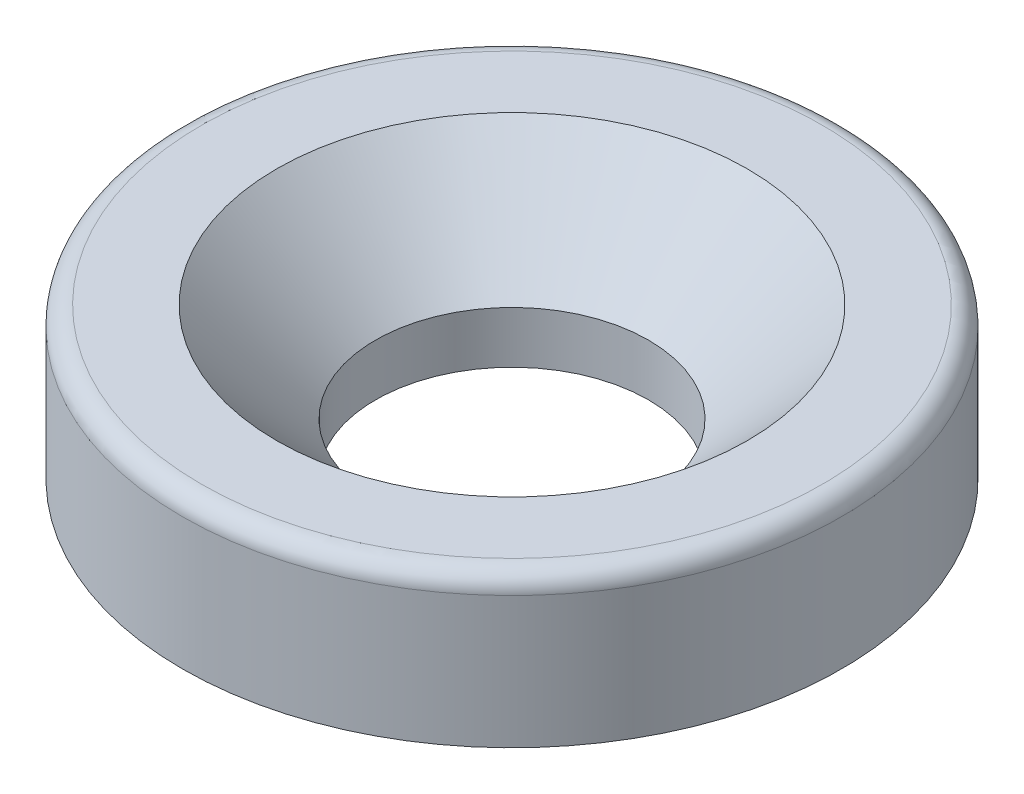
from build123d import *

# Parameters (mm, degrees)
SKETCH1_W = 17.5
SKETCH1_H = 8
FILLET1_R = 1


with BuildPart() as part:
    # Sketch1 → Revolve1 (revolve)
    with BuildSketch(Plane.XY, mode=Mode.PRIVATE) as revolve1_sk:
        with Locations((8.75, 4)):
            Rectangle(SKETCH1_W, SKETCH1_H)
    revolve(revolve1_sk.sketch.rotate(Axis((0, 0, 0), (0, 1, 0)), 90), axis=Axis((0, 0, 0), (0, 1, 0)))

    # Sketch2 → CSK for M3 Countersunk Flat Head Screw1 (revolve, cut)
    with BuildSketch(Plane(origin=(0, 8, 0), x_dir=(0, 0, 1), z_dir=(1, 0, 0))):
        Polygon((0, 0), (0, 8), (7.25, 8), (7.25, 5.25), (12.5, 0), align=None)
    revolve(axis=Axis((0, 14.35, 0), (0, -1, 0)), mode=Mode.SUBTRACT)

    # Fillet1
    fillet1_edges = [part.edges().sort_by_distance(p)[0] for p in [
        (0, 8, 17.5),
    ]]
    fillet(fillet1_edges, radius=FILLET1_R)


solid = part.part
